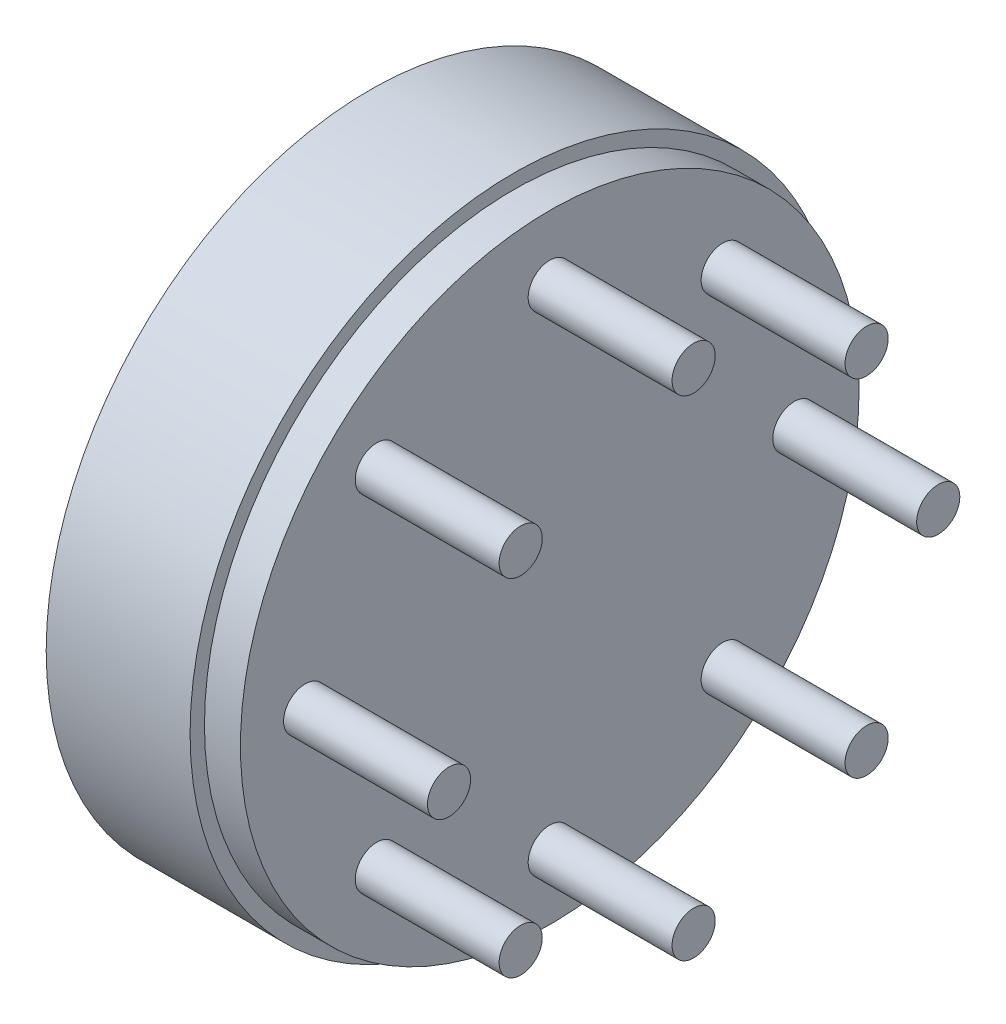
from build123d import *

# Parameters (mm, degrees)
SKETCH2_R           = 215
BOSS_EXTRUDE1_DEPTH = 25
SKETCH3_R           = 225
BOSS_EXTRUDE2_DEPTH = 100
SKETCH5_R           = 15
BOSS_EXTRUDE3_DEPTH = 100


with BuildPart() as part:
    # Sketch2 → Boss-Extrude1 (new body)
    with BuildSketch(Plane(origin=(1124.08, 0, 0), x_dir=(0, 0, -1), z_dir=(1, 0, 0))):
        Circle(SKETCH2_R)
    extrude(amount=-BOSS_EXTRUDE1_DEPTH)

    # Sketch3 → Boss-Extrude2 (add)
    with BuildSketch(Plane.ZY.offset(-1099.08)):
        Circle(SKETCH3_R)
    extrude(amount=BOSS_EXTRUDE2_DEPTH)

    # Sketch5 → Boss-Extrude3 (add)
    with BuildSketch(Plane(origin=(1124.08, 0, 0), x_dir=(0, 0, -1), z_dir=(1, 0, 0))):
        with Locations((0, 170)):
            Circle(SKETCH5_R)
        with Locations((120.208152802, 120.208152802)):
            Circle(SKETCH5_R)
        with Locations((170, 0)):
            Circle(SKETCH5_R)
        with Locations((120.208152802, -120.208152802)):
            Circle(SKETCH5_R)
        with Locations((0, -170)):
            Circle(SKETCH5_R)
        with Locations((-120.208152802, -120.208152802)):
            Circle(SKETCH5_R)
        with Locations((-170, 0)):
            Circle(SKETCH5_R)
        with Locations((-120.208152802, 120.208152802)):
            Circle(SKETCH5_R)
    extrude(amount=BOSS_EXTRUDE3_DEPTH)


solid = part.part
